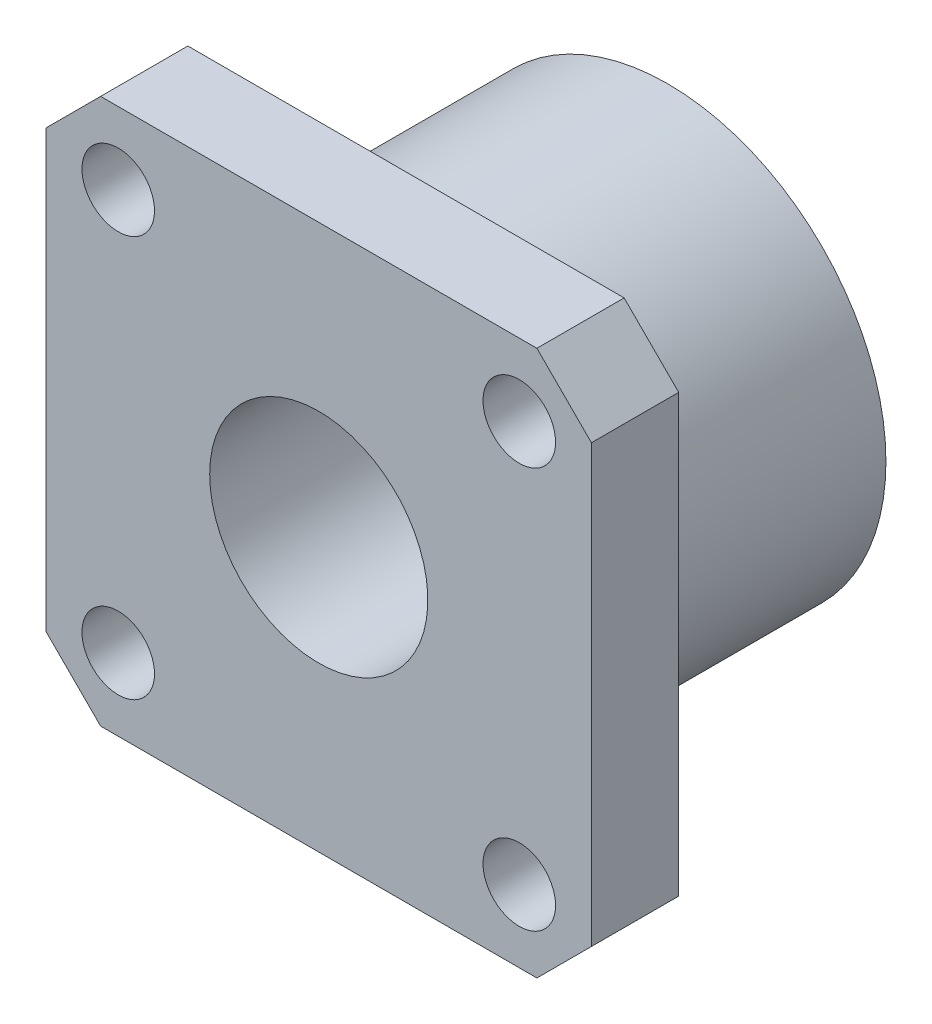
from build123d import *

# Parameters (mm, degrees)
SKETCH_1_W          = 50
SKETCH_1_H          = 50
SKETCH_1_R          = 3.325
EXTRUDE_1_DEPTH     = 8
CHAMFER_1_SIZE      = 5
SKETCH_2_R          = 20
SKETCH_2_R_2        = 10
EXTRUDE_2_DEPTH     = 24
SKETCH_3_R          = 10
CUT_EXTRUDE_1_DEPTH = 43.731721238


with BuildPart() as part:
    # 草图1 → 凸台-拉伸1 (new body)
    with BuildSketch(Plane.XY):
        Rectangle(SKETCH_1_W, SKETCH_1_H)
        with Locations((-18.384776311, 18.384776311)):
            Circle(SKETCH_1_R, mode=Mode.SUBTRACT)
        with Locations((18.384776311, 18.384776311)):
            Circle(SKETCH_1_R, mode=Mode.SUBTRACT)
        with Locations((18.384776311, -18.384776311)):
            Circle(SKETCH_1_R, mode=Mode.SUBTRACT)
        with Locations((-18.384776311, -18.384776311)):
            Circle(SKETCH_1_R, mode=Mode.SUBTRACT)
    extrude(amount=EXTRUDE_1_DEPTH)

    # 倒角1
    chamfer_1_edges = [part.edges().sort_by_distance(p)[0] for p in [
        (-25, 25, 4),
        (25, 25, 4),
        (25, -25, 4),
        (-25, -25, 4),
    ]]
    chamfer(chamfer_1_edges, length=CHAMFER_1_SIZE)

    # 草图2 → 凸台-拉伸2 (add)
    with BuildSketch(Plane(origin=(0, 0, 0), x_dir=(-1, 0, 0), z_dir=(0, 0, -1))):
        with Locations(Location((0, 0, 0), (0, 0, 180))):
            Circle(SKETCH_2_R)
        Circle(SKETCH_2_R_2, mode=Mode.SUBTRACT)
    extrude(amount=EXTRUDE_2_DEPTH)

    # 草图3 → 切除-拉伸1 (cut, through all)
    with BuildSketch(Plane(origin=(0, 0, 0), x_dir=(-1, 0, 0), z_dir=(0, 0, -1))):
        Circle(SKETCH_3_R)
    extrude(amount=-CUT_EXTRUDE_1_DEPTH, mode=Mode.SUBTRACT)


solid = part.part
